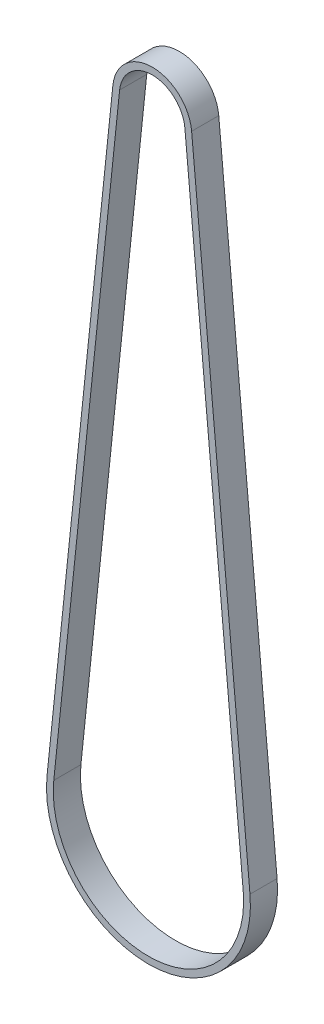
from build123d import *

# Parameters (mm, degrees)
EXTRUDE_1_DEPTH = 6


with BuildPart() as part:
    # 草图2 → 拉伸-薄壁1 (new body)
    with BuildSketch(Plane.XY):
        with BuildLine():
            Line((-23.267359636, -138.596127362), (-8.702699219, 0.908584785))
            ThreePointArc((-8.702699219, 0.908584785), (0.052103875, 8.749844866), (8.712902604, 0.804877765))
            Line((8.712902604, 0.804877765), (21.615134204, -138.863395168))
            ThreePointArc((21.615134204, -138.863395168), (-0.973539635, -163.487280349), (-23.267359636, -138.596127362))
        make_face()
        with BuildLine():
            Line((-21.775468341, -138.751884754), (-7.210807924, 0.752827393))
            ThreePointArc((-7.210807924, 0.752827393), (0.043171782, 7.249871461), (7.219262157, 0.666898719))
            Line((7.219262157, 0.666898719), (20.121493757, -139.001374214))
            ThreePointArc((20.121493757, -139.001374214), (-0.964607542, -161.987306943), (-21.775468341, -138.751884754))
        make_face(mode=Mode.SUBTRACT)
    extrude(amount=EXTRUDE_1_DEPTH)


solid = part.part
